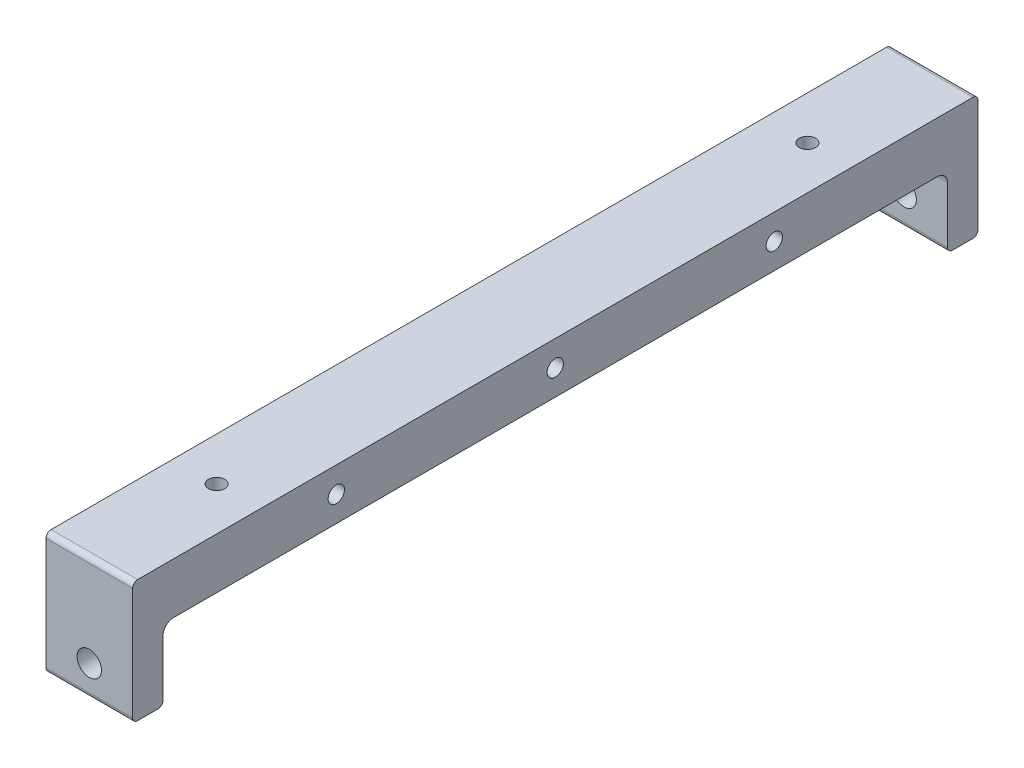
from build123d import *

# Parameters (mm, degrees)
SKETCH1_W           = 8.5
SKETCH1_H           = 12
BOSS_EXTRUDE1_DEPTH = 41.5
CUT_EXTRUDE1_DEPTH  = 43.784342931
FILLET1_R           = 0.5
M2_HOLE1_R_D        = 1.6
M2_HOLE1_R_DEPTH    = 5
M2_HOLE1_R_TIP      = 0.480688495
M2_HOLE2_T_D        = 1.6
M2_HOLE2_T_DEPTH    = 4
M2_HOLE2_T_TIP      = 0.480688495
M2_HOLE3_U_D        = 2.4
M2_HOLE3_U_DEPTH    = 10
M2_HOLE3_U_TIP      = 0.721032743
M2_HOLE4_V_D        = 1.6
M2_HOLE5_W_D        = 1.6
M2_HOLE5_W_DEPTH    = 5
M2_HOLE5_W_TIP      = 0.480688495
M2_HOLE6_Y_D        = 2.4
M2_HOLE6_Y_DEPTH    = 10
M2_HOLE6_Y_TIP      = 0.721032743


with BuildPart() as part:
    # Sketch1 → Boss-Extrude1 (new, symmetric)
    with BuildSketch(Plane.XY):
        Rectangle(SKETCH1_W, SKETCH1_H)
    extrude(amount=BOSS_EXTRUDE1_DEPTH, both=True)

    # Sketch2 → Cut-Extrude1 (cut, through all)
    with BuildSketch(Plane(origin=(4.25, 0, 0), x_dir=(0, 0, -1), z_dir=(1, 0, 0))):
        with BuildLine():
            Line((-37.5, 1), (37.5, 1))
            ThreePointArc((37.5, 1), (38.207106781, 0.707106781), (38.5, 0))
            Line((38.5, 0), (38.5, -6))
            Line((38.5, -6), (-38.5, -6))
            Line((-38.5, -6), (-38.5, 0))
            ThreePointArc((-38.5, 0), (-38.207106781, 0.707106781), (-37.5, 1))
        make_face()
    extrude(amount=-CUT_EXTRUDE1_DEPTH, mode=Mode.SUBTRACT)

    # Fillet1
    fillet1_edges = [part.edges().sort_by_distance(p)[0] for p in [
        (0, -6, 41.5),
        (0, -6, -38.5),
        (0, -6, 38.5),
        (0, -6, -41.5),
        (0, 6, -41.5),
        (0, 6, 41.5),
    ]]
    fillet(fillet1_edges, radius=FILLET1_R)

    # M2 Hole1-R
    with Locations(Plane(origin=(4.25, 0, 0), x_dir=(0, 0, -1), z_dir=(1, 0, 0))):
        with Locations((21.5, 3.5), (-21.5, 3.5)):
            Hole(M2_HOLE1_R_D / 2, depth=M2_HOLE1_R_DEPTH)
            with Locations((0, 0, -(M2_HOLE1_R_DEPTH + M2_HOLE1_R_TIP / 2))):  # 118° drill point
                Cone(0, M2_HOLE1_R_D / 2, M2_HOLE1_R_TIP, mode=Mode.SUBTRACT)

    # M2 Hole2-T
    with Locations(Plane(origin=(4.25, 0, 0), x_dir=(0, 0, -1), z_dir=(1, 0, 0))):
        with Locations((0, 3.5)):
            Hole(M2_HOLE2_T_D / 2, depth=M2_HOLE2_T_DEPTH)
            with Locations((0, 0, -(M2_HOLE2_T_DEPTH + M2_HOLE2_T_TIP / 2))):  # 118° drill point
                Cone(0, M2_HOLE2_T_D / 2, M2_HOLE2_T_TIP, mode=Mode.SUBTRACT)

    # M2 Hole3-U
    with Locations(Plane.XY.offset(41.5)):
        with Locations((0, -3)):
            Hole(M2_HOLE3_U_D / 2, depth=M2_HOLE3_U_DEPTH)
            with Locations((0, 0, -(M2_HOLE3_U_DEPTH + M2_HOLE3_U_TIP / 2))):  # 118° drill point
                Cone(0, M2_HOLE3_U_D / 2, M2_HOLE3_U_TIP, mode=Mode.SUBTRACT)

    # M2 Hole4-V (through all)
    with Locations(Plane(origin=(0, 6, 0), x_dir=(1, 0, 0), z_dir=(0, 1, 0))):
        with Locations((0, 29), (0, -29)):
            Hole(M2_HOLE4_V_D / 2)

    # M2 Hole5-W
    with Locations(Plane.ZY.offset(4.25)):
        with Locations((-35.5, 3.5), (35.5, 3.5)):
            Hole(M2_HOLE5_W_D / 2, depth=M2_HOLE5_W_DEPTH)
            with Locations((0, 0, -(M2_HOLE5_W_DEPTH + M2_HOLE5_W_TIP / 2))):  # 118° drill point
                Cone(0, M2_HOLE5_W_D / 2, M2_HOLE5_W_TIP, mode=Mode.SUBTRACT)

    # M2 Hole6-Y
    with Locations(Plane(origin=(0, 0, -41.5), x_dir=(-1, 0, 0), z_dir=(0, 0, -1))):
        with Locations((0, -3)):
            Hole(M2_HOLE6_Y_D / 2, depth=M2_HOLE6_Y_DEPTH)
            with Locations((0, 0, -(M2_HOLE6_Y_DEPTH + M2_HOLE6_Y_TIP / 2))):  # 118° drill point
                Cone(0, M2_HOLE6_Y_D / 2, M2_HOLE6_Y_TIP, mode=Mode.SUBTRACT)


solid = part.part
